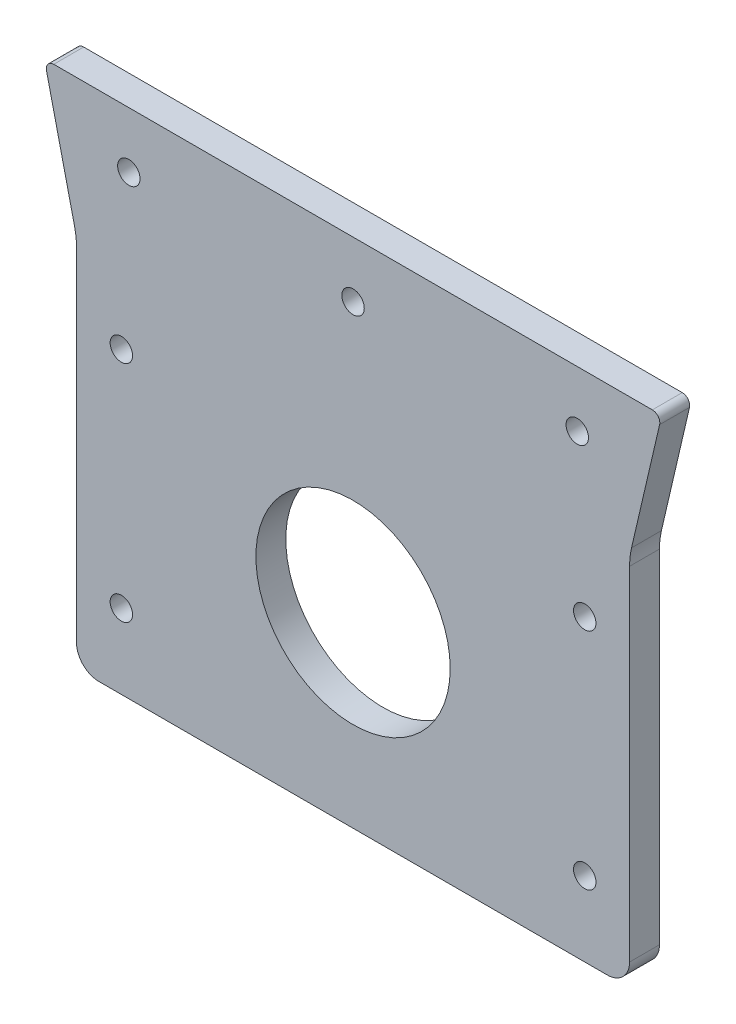
from build123d import *

# Parameters (mm, degrees)
SKETCH_1_W            = 74
SKETCH_1_H            = 50
EXTRUDE_1_DEPTH       = 4
CUT_EXTRUDE_1_DEPTH   = 63.787339488
MIRROR_2_COPY_1_DEPTH = 63.787339488
SKETCH_3_R            = 13
CUT_EXTRUDE_2_DEPTH   = 63.787339488
FILLET_1_R            = 10
SKETCH_4_W            = 84
SKETCH_4_H            = 62
EXTRUDE_2_DEPTH       = 4
SKETCH_6_W            = 18
SKETCH_6_H            = 44
EXTRUDE_3_DEPTH       = 4
SKETCH_7_W            = 64
SKETCH_7_H            = 22
CUT_EXTRUDE_4_DEPTH   = 125.049385327
SKETCH_8_R            = 1.5
CUT_EXTRUDE_5_DEPTH   = 125.049385327
SKETCH_9_R            = 1.5
CUT_EXTRUDE_6_DEPTH   = 125.049385327
SKETCH_10_R           = 1.5
CUT_EXTRUDE_7_DEPTH   = 125.049385327
FILLET_2_R            = 3
SKETCH_11_W           = 20
SKETCH_11_H           = 18
CUT_EXTRUDE_8_DEPTH   = 125.049385327
FILLET_3_R            = 3
SKETCH_12_W           = 122.856865441
SKETCH_12_H           = 61.545901124
CUT_EXTRUDE_9_DEPTH   = 125.049385327
FILLET_4_R            = 3
FILLET_5_R            = 3
SKETCH_13_R           = 1.5
CUT_EXTRUDE_10_DEPTH  = 92.149602303
SKETCH_14_W           = 150.805924756
SKETCH_14_H           = 61.126695491
CUT_EXTRUDE_11_DEPTH  = 92.149602303
FILLET_6_R            = 1


with BuildPart() as part:
    # 草图1 → 凸台-拉伸1 (new body)
    with BuildSketch(Plane.XY):
        Polygon((37, 25), (42, 46.5), (-42, 46.5), (-37, 25), align=None)
        Rectangle(SKETCH_1_W, SKETCH_1_H)
    extrude(amount=EXTRUDE_1_DEPTH)

    # 草图2 → 切除-拉伸1 (cut, through all)
    with BuildSketch(Plane.XY.offset(4)):
        with BuildLine():
            ThreePointArc((29.5, 15), (29.939339828, 13.939339828), (31, 13.5))
            Line((31, 13.5), (31, 15))
            Line((31, 15), (29.5, 15))
        make_face()
        with BuildLine():
            Line((31, 15), (31, 13.5))
            ThreePointArc((31, 13.5), (32.060660172, 13.939339828), (32.5, 15))
            ThreePointArc((32.5, 15), (31, 16.5), (29.5, 15))
            Line((29.5, 15), (31, 15))
        make_face()
    cut_extrude_1 = extrude(amount=-CUT_EXTRUDE_1_DEPTH, mode=Mode.SUBTRACT)

    # 镜向1: 切除-拉伸1 across plane
    add(cut_extrude_1.mirror(Plane.ZX), mode=Mode.SUBTRACT)

    # 镜向2: 切除-拉伸1 across plane
    add(cut_extrude_1.mirror(Plane(origin=(0, 0, 0), x_dir=(0, 0, 1), z_dir=(1, 0, 0))), mode=Mode.SUBTRACT)

    # 镜向2 copy 1 sketch → 镜向2 copy 1 (cut, through all)
    with BuildSketch(Plane(origin=(0, 0, 4), x_dir=(-1, 0, 0), z_dir=(0, 0, 1))):
        with BuildLine():
            ThreePointArc((29.5, 15), (29.939339828, 13.939339828), (31, 13.5))
            Line((31, 13.5), (31, 15))
            Line((31, 15), (29.5, 15))
        make_face()
        with BuildLine():
            Line((31, 15), (31, 13.5))
            ThreePointArc((31, 13.5), (32.060660172, 13.939339828), (32.5, 15))
            ThreePointArc((32.5, 15), (31, 16.5), (29.5, 15))
            Line((29.5, 15), (31, 15))
        make_face()
    extrude(amount=-MIRROR_2_COPY_1_DEPTH, mode=Mode.SUBTRACT)

    # 草图3 → 切除-拉伸2 (cut, through all)
    with BuildSketch(Plane.XY.offset(4)):
        Circle(SKETCH_3_R)
    extrude(amount=-CUT_EXTRUDE_2_DEPTH, mode=Mode.SUBTRACT)

    # 圆角1
    fillet_1_edges = [part.edges().sort_by_distance(p)[0] for p in [
        (37, 25, 2),
        (-37, 25, 2),
    ]]
    fillet(fillet_1_edges, radius=FILLET_1_R)

    # 草图4 → 凸台-拉伸2 (add)
    with BuildSketch(Plane.XY.offset(4)):
        with Locations((0, 77.5)):
            Rectangle(SKETCH_4_W, SKETCH_4_H)
    extrude(amount=-EXTRUDE_2_DEPTH)

    # 草图6 → 凸台-拉伸3 (add)
    with BuildSketch(Plane.XY.offset(4)):
        with Locations((-51, 68.5)):
            Rectangle(SKETCH_6_W, SKETCH_6_H)
    extrude_3 = extrude(amount=-EXTRUDE_3_DEPTH)

    # 镜向4: 凸台-拉伸3 across plane
    add(extrude_3.mirror(Plane(origin=(0, 0, 0), x_dir=(0, 0, 1), z_dir=(1, 0, 0))))

    # 草图7 → 切除-拉伸4 (cut, through all)
    with BuildSketch(Plane.XY.offset(4)):
        with Locations((0, 69.5)):
            Rectangle(SKETCH_7_W, SKETCH_7_H)
    extrude(amount=-CUT_EXTRUDE_4_DEPTH, mode=Mode.SUBTRACT)

    # 草图8 → 切除-拉伸5 (cut, through all)
    with BuildSketch(Plane.XY.offset(4)):
        with Locations((0, 101)):
            Circle(SKETCH_8_R)
        with Locations((-24, 101)):
            Circle(SKETCH_8_R)
    cut_extrude_5 = extrude(amount=-CUT_EXTRUDE_5_DEPTH, mode=Mode.SUBTRACT)

    # 镜向5: 切除-拉伸5 across plane
    add(cut_extrude_5.mirror(Plane(origin=(0, 0, 0), x_dir=(0, 0, 1), z_dir=(1, 0, 0))), mode=Mode.SUBTRACT)

    # 草图9 → 切除-拉伸6 (cut, through all)
    with BuildSketch(Plane(origin=(0, 0, 0), x_dir=(-1, 0, 0), z_dir=(0, 0, -1))):
        with Locations((-52.5, 83.5)):
            Circle(SKETCH_9_R)
        with Locations((-52.5, 61)):
            Circle(SKETCH_9_R)
    cut_extrude_6 = extrude(amount=-CUT_EXTRUDE_6_DEPTH, mode=Mode.SUBTRACT)

    # 镜向6: 切除-拉伸6 across plane
    add(cut_extrude_6.mirror(Plane(origin=(0, 0, 0), x_dir=(0, 0, 1), z_dir=(1, 0, 0))), mode=Mode.SUBTRACT)

    # 草图10 → 切除-拉伸7 (cut, through all)
    with BuildSketch(Plane(origin=(0, 0, 0), x_dir=(-1, 0, 0), z_dir=(0, 0, -1))):
        with Locations((-30, 36)):
            Circle(SKETCH_10_R)
    cut_extrude_7 = extrude(amount=-CUT_EXTRUDE_7_DEPTH, mode=Mode.SUBTRACT)

    # 镜向7: 切除-拉伸7 across plane
    add(cut_extrude_7.mirror(Plane(origin=(0, 0, 0), x_dir=(0, 0, 1), z_dir=(1, 0, 0))), mode=Mode.SUBTRACT)

    # 圆角2
    fillet_2_edges = [part.edges().sort_by_distance(p)[0] for p in [
        (32, 80.5, 2),
        (32, 58.5, 2),
        (-32, 58.5, 2),
        (-32, 80.5, 2),
        (-42, 46.5, 2),
        (42, 46.5, 2),
        (-42, 90.5, 2),
        (42, 90.5, 2),
    ]]
    fillet(fillet_2_edges, radius=FILLET_2_R)

    # 草图11 → 切除-拉伸8 (cut, through all)
    with BuildSketch(Plane(origin=(0, 0, 0), x_dir=(-1, 0, 0), z_dir=(0, 0, -1))):
        with Locations((-50, 99.5)):
            Rectangle(SKETCH_11_W, SKETCH_11_H)
    cut_extrude_8 = extrude(amount=-CUT_EXTRUDE_8_DEPTH, mode=Mode.SUBTRACT)

    # 镜向8: 切除-拉伸8 across plane
    add(cut_extrude_8.mirror(Plane(origin=(0, 0, 0), x_dir=(0, 0, 1), z_dir=(1, 0, 0))), mode=Mode.SUBTRACT)

    # 圆角3
    fillet_3_edges = [part.edges().sort_by_distance(p)[0] for p in [
        (40, 90.5, 2),
        (-40, 90.5, 2),
    ]]
    fillet(fillet_3_edges, radius=FILLET_3_R)

    # 草图12 → 切除-拉伸9 (cut, through all)
    with BuildSketch(Plane(origin=(0, 0, 0), x_dir=(-1, 0, 0), z_dir=(0, 0, -1))):
        with Locations((1.42843272, 99.272950562)):
            Rectangle(SKETCH_12_W, SKETCH_12_H)
    extrude(amount=-CUT_EXTRUDE_9_DEPTH, mode=Mode.SUBTRACT)

    # 圆角4
    fillet_4_edges = [part.edges().sort_by_distance(p)[0] for p in [
        (-32, 68.5, 2),
        (32, 68.5, 2),
    ]]
    fillet(fillet_4_edges, radius=FILLET_4_R)

    # 圆角5
    fillet_5_edges = [part.edges().sort_by_distance(p)[0] for p in [
        (37, -25, 2),
        (-37, -25, 2),
    ]]
    fillet(fillet_5_edges, radius=FILLET_5_R)

    # 草图13 → 切除-拉伸10 (cut, through all)
    with BuildSketch(Plane.XY.offset(4)):
        with Locations((0, 36)):
            Circle(SKETCH_13_R)
    extrude(amount=-CUT_EXTRUDE_10_DEPTH, mode=Mode.SUBTRACT)

    # 草图14 → 切除-拉伸11 (cut, through all)
    with BuildSketch(Plane.XY.offset(4)):
        with Locations((-9.796052063, 74.063347746)):
            Rectangle(SKETCH_14_W, SKETCH_14_H)
    extrude(amount=-CUT_EXTRUDE_11_DEPTH, mode=Mode.SUBTRACT)

    # 圆角6
    fillet_6_edges = [part.edges().sort_by_distance(p)[0] for p in [
        (-41.302325581, 43.5, 2),
        (41.302325581, 43.5, 2),
    ]]
    fillet(fillet_6_edges, radius=FILLET_6_R)


solid = part.part
